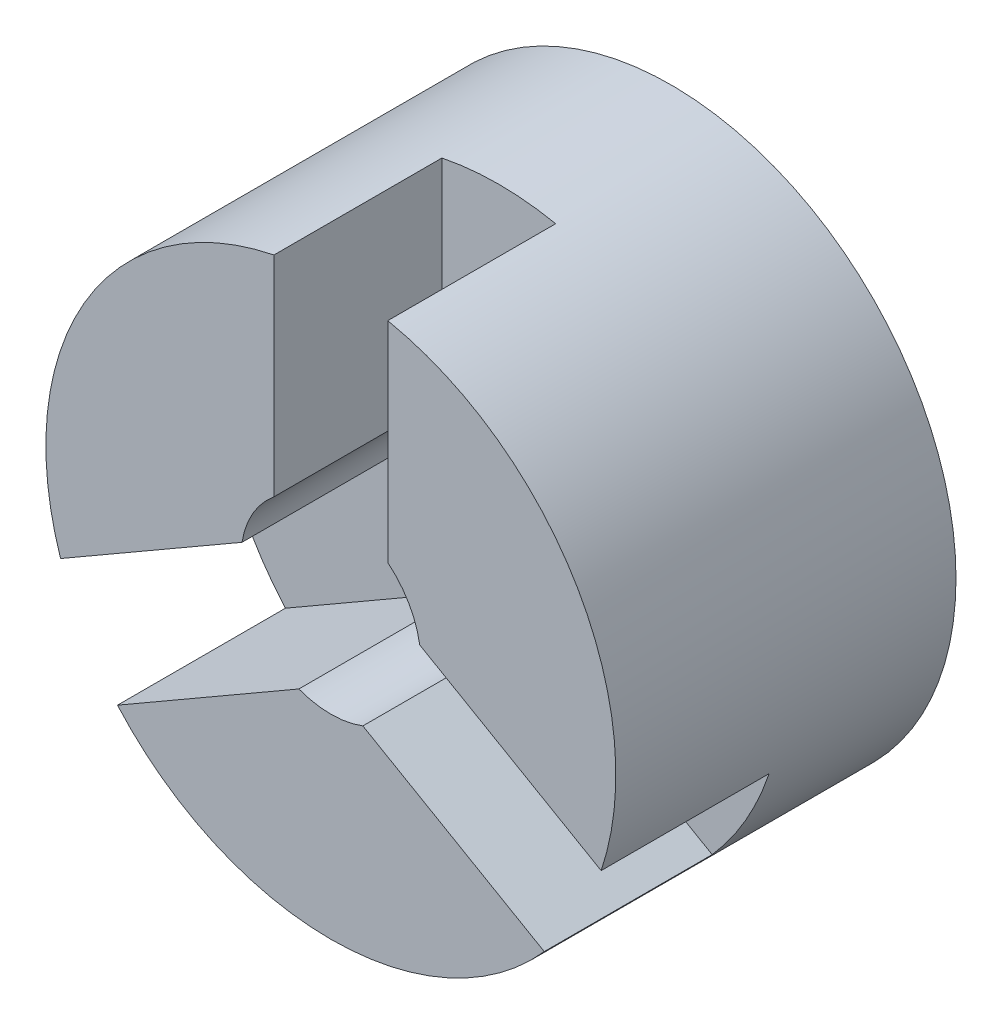
from build123d import *

# Parameters (mm, degrees)
SKETCH1_R          = 15
EXTRUDE1_DEPTH     = 33
SKETCH2_R          = 7.5
CUT_EXTRUDE1_DEPTH = 3
SKETCH3_R          = 25
EXTRUDE2_DEPTH     = 29.84000001
CUT_EXTRUDE2_DEPTH = 14.732
CIRPATTERN1_COUNT  = 3
SKETCH6_R          = 6.5
CUT_EXTRUDE4_DEPTH = 10
CUT_EXTRUDE3_REACH = 51.637
SKETCH5_R          = 7.8994


with BuildPart() as part:
    # Sketch1 → Extrude1 (new body)
    with BuildSketch(Plane.XY):
        Circle(SKETCH1_R)
    extrude(amount=EXTRUDE1_DEPTH)

    # Sketch2 → Cut-Extrude1 (cut)
    with BuildSketch(Plane(origin=(0, 0, 0), x_dir=(-1, 0, 0), z_dir=(0, 0, -1))):
        Circle(SKETCH2_R)
    extrude(amount=-CUT_EXTRUDE1_DEPTH, mode=Mode.SUBTRACT)

    # Sketch3 → Extrude2 (add)
    with BuildSketch(Plane.XY.offset(4.999999906)):
        Circle(SKETCH3_R)
    extrude(amount=EXTRUDE2_DEPTH)

    # Sketch4 → Cut-Extrude2 (cut)
    with BuildSketch(Plane.XY.offset(34.839999916)):
        Polygon((0, 0), (4.9911, 0), (4.9911, 26.885801132), (-4.9911, 26.885801132), (-4.9911, 0), align=None)
    cut_extrude2 = extrude(amount=-CUT_EXTRUDE2_DEPTH, mode=Mode.SUBTRACT)

    # CirPattern1: Cut-Extrude2 ×3 about axis
    cirpattern1_axis = Axis((0, 0, 0), (0, 0, 1))
    for i in range(1, CIRPATTERN1_COUNT):
        add(cut_extrude2.rotate(cirpattern1_axis, i * 360 / CIRPATTERN1_COUNT), mode=Mode.SUBTRACT)

    # Sketch6 → Cut-Extrude4 (cut)
    with BuildSketch(Plane(origin=(0, 0, 3), x_dir=(-1, 0, 0), z_dir=(0, 0, -1))):
        Circle(SKETCH6_R)
    extrude(amount=-CUT_EXTRUDE4_DEPTH, mode=Mode.SUBTRACT)

    # Cut-Extrude3: up to this face of the body (flat: up to its plane)
    cut_extrude3_end = Plane(part.part.faces().sort_by_distance((0, 0, 13))[0])
    # Sketch5 → Cut-Extrude3 (cut, up to the picked face)
    with BuildSketch(Plane.XY.offset(34.839999916), mode=Mode.PRIVATE) as cut_extrude3_sk1:
        with Locations(Location((0, 0, 0), (0, 0, 9.185472822))):
            Circle(SKETCH5_R)
    cut_extrude3_tool1 = split(extrude(cut_extrude3_sk1.sketch, amount=-CUT_EXTRUDE3_REACH, mode=Mode.PRIVATE), bisect_by=cut_extrude3_end, keep=Keep.BOTH, mode=Mode.PRIVATE)
    add(cut_extrude3_tool1.solids().sort_by(Axis((0, 0, 34.84), (0, 0, -1)))[0], mode=Mode.SUBTRACT)


solid = part.part
